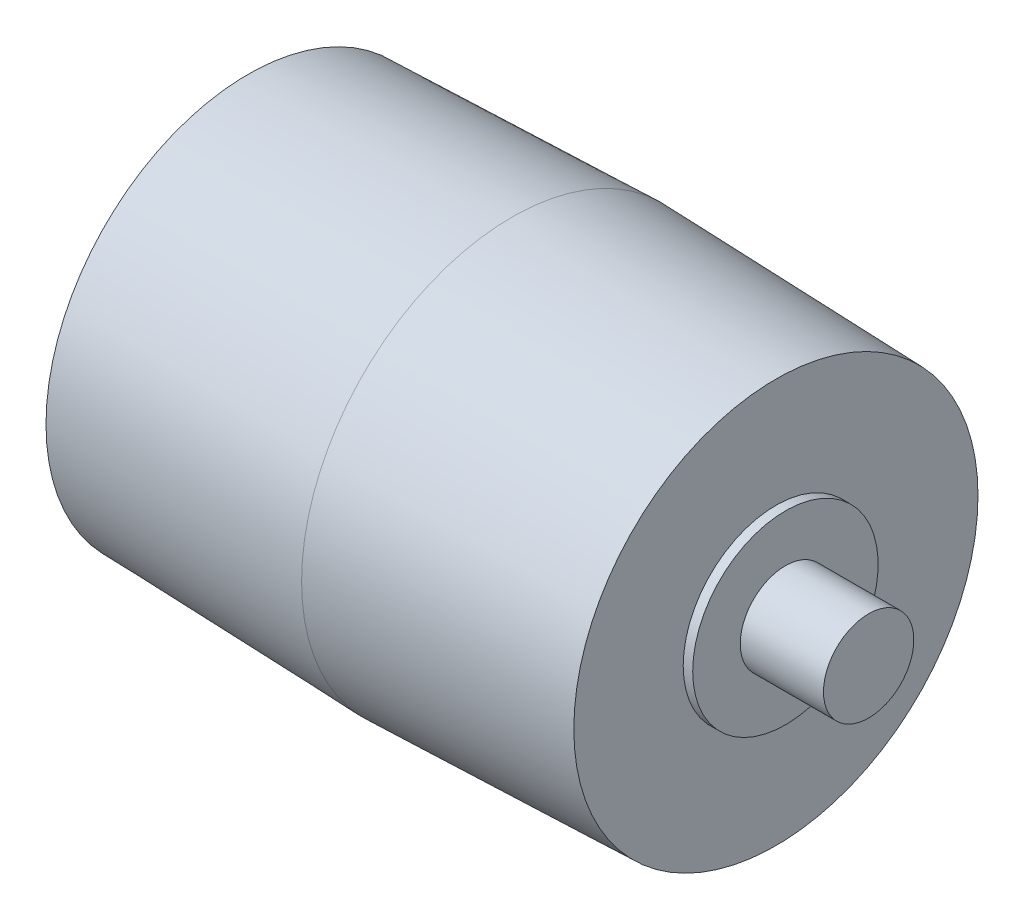
from build123d import *


with BuildPart() as part:
    # Sketch1 → Revolve1 (revolve)
    with BuildSketch(Plane.XY, mode=Mode.PRIVATE) as revolve1_sk:
        Polygon((-9.525, 0), (-9.525, 1.2065), (-7.3025, 1.2065), (-7.3025, 2.4765), (-7.0485, 2.4765), (-7.0485, 5.3975), (0, 5.61975), (7.0485, 5.3975), (7.0485, 2.4765), (7.3025, 2.4765), (7.3025, 1.2065), (9.525, 1.2065), (9.525, 0), align=None)
    revolve(revolve1_sk.sketch.rotate(Axis((-9.525, 0, 0), (1, 0, 0)), 90), axis=Axis((-9.525, 0, 0), (1, 0, 0)))


solid = part.part
